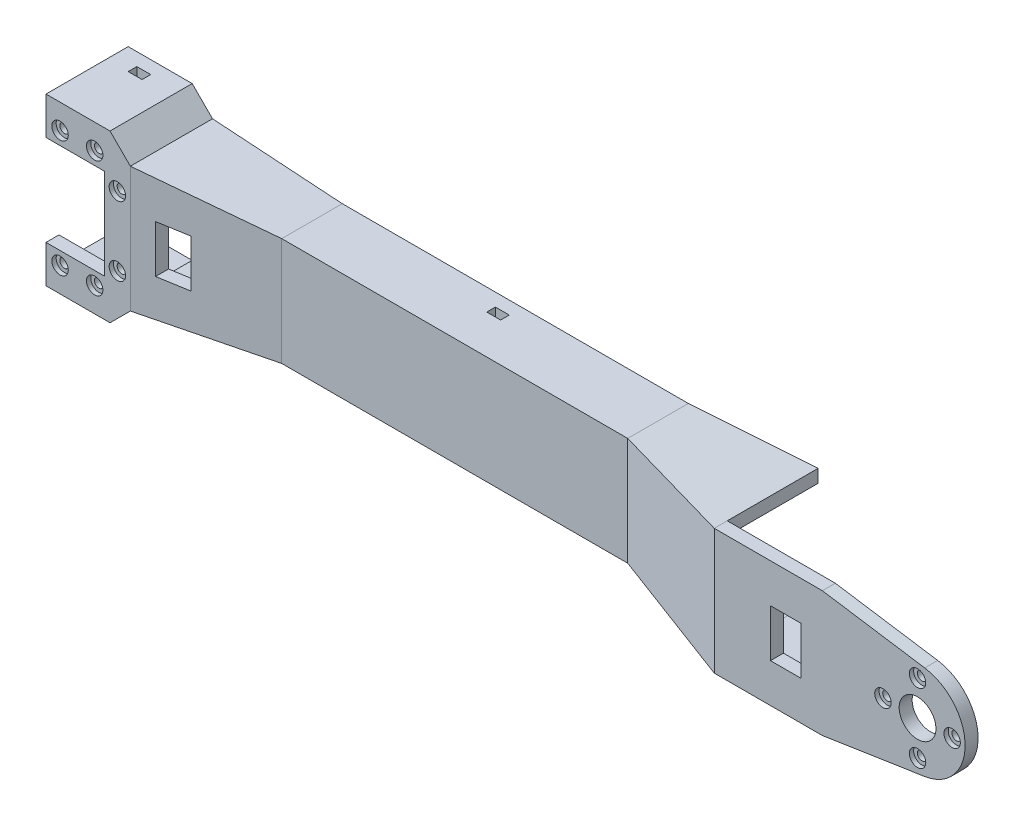
from build123d import *

# Parameters (mm, degrees)
BOSS_EXTRUDE1_DEPTH = 3
CUT_EXTRUDE1_REACH  = 66.915
SKETCH2_R           = 4.25
SKETCH2_R_2         = 1.05
SKETCH3_R           = 1.9
CUT_EXTRUDE2_DEPTH  = 1
BOSS_EXTRUDE2_DEPTH = 29
BOSS_EXTRUDE4_DEPTH = 3
CUT_EXTRUDE3_REACH  = 165.217
SKETCH8_R           = 1.05
SKETCH9_R           = 1.9
CUT_EXTRUDE4_DEPTH  = 1
CUT_EXTRUDE5_REACH  = 165.539
BOSS_EXTRUDE8_REACH = 166.778
SKETCH16_W          = 3.2
SKETCH16_H          = 2
CUT_EXTRUDE6_DEPTH  = 166.80352831
CUT_EXTRUDE7_REACH  = 166.778
SKETCH17_W          = 7
SKETCH17_H          = 11
SKETCH18_W          = 25
SKETCH18_H          = 3
CUT_EXTRUDE8_DEPTH  = 21


with BuildPart() as part:
    # Sketch1 → Boss-Extrude1 (new body)
    with BuildSketch(Plane.XY):
        with BuildLine():
            Line((25, 29), (48.666332079, 25.373055569))
            ThreePointArc((48.666332079, 25.373055569), (58, 14.5), (48.666332079, 3.626944431))
            Line((48.666332079, 3.626944431), (25, 0))
            Line((25, 0), (0, 0))
            Line((0, 0), (0, 29))
            Line((0, 29), (25, 29))
        make_face()
    extrude(amount=-BOSS_EXTRUDE1_DEPTH)

    # Sketch2 → Cut-Extrude1 (cut, up to next)
    with BuildSketch(Plane.XY, mode=Mode.PRIVATE) as cut_extrude1_sk1:
        with Locations((47, 14.5)):
            Circle(SKETCH2_R)
    cut_extrude1_tool1 = extrude(cut_extrude1_sk1.sketch, amount=-CUT_EXTRUDE1_REACH, mode=Mode.PRIVATE) & part.part
    # Sketch2 → Cut-Extrude1 (cut, up to next)
    with BuildSketch(Plane.XY, mode=Mode.PRIVATE) as cut_extrude1_sk2:
        with Locations((47, 22.5)):
            Circle(SKETCH2_R_2)
    cut_extrude1_tool2 = extrude(cut_extrude1_sk2.sketch, amount=-CUT_EXTRUDE1_REACH, mode=Mode.PRIVATE) & part.part
    # Sketch2 → Cut-Extrude1 (cut, up to next)
    with BuildSketch(Plane.XY, mode=Mode.PRIVATE) as cut_extrude1_sk3:
        with Locations((55, 14.5)):
            Circle(SKETCH2_R_2)
    cut_extrude1_tool3 = extrude(cut_extrude1_sk3.sketch, amount=-CUT_EXTRUDE1_REACH, mode=Mode.PRIVATE) & part.part
    # Sketch2 → Cut-Extrude1 (cut, up to next)
    with BuildSketch(Plane.XY, mode=Mode.PRIVATE) as cut_extrude1_sk4:
        with Locations((47, 6.5)):
            Circle(SKETCH2_R_2)
    cut_extrude1_tool4 = extrude(cut_extrude1_sk4.sketch, amount=-CUT_EXTRUDE1_REACH, mode=Mode.PRIVATE) & part.part
    # Sketch2 → Cut-Extrude1 (cut, up to next)
    with BuildSketch(Plane.XY, mode=Mode.PRIVATE) as cut_extrude1_sk5:
        with Locations((39, 14.5)):
            Circle(SKETCH2_R_2)
    cut_extrude1_tool5 = extrude(cut_extrude1_sk5.sketch, amount=-CUT_EXTRUDE1_REACH, mode=Mode.PRIVATE) & part.part
    add(cut_extrude1_tool1.solids().sort_by_distance((47, 14.5, 0))[0], mode=Mode.SUBTRACT)
    add(cut_extrude1_tool2.solids().sort_by_distance((47, 22.5, 0))[0], mode=Mode.SUBTRACT)
    add(cut_extrude1_tool3.solids().sort_by_distance((55, 14.5, 0))[0], mode=Mode.SUBTRACT)
    add(cut_extrude1_tool4.solids().sort_by_distance((47, 6.5, 0))[0], mode=Mode.SUBTRACT)
    add(cut_extrude1_tool5.solids().sort_by_distance((39, 14.5, 0))[0], mode=Mode.SUBTRACT)

    # Sketch3 → Cut-Extrude2 (cut)
    with BuildSketch(Plane.XY):
        with Locations((47, 22.5)):
            Circle(SKETCH3_R)
        with Locations((55, 14.5)):
            Circle(SKETCH3_R)
        with Locations((47, 6.5)):
            Circle(SKETCH3_R)
        with Locations((39, 14.5)):
            Circle(SKETCH3_R)
    extrude(amount=-CUT_EXTRUDE2_DEPTH, mode=Mode.SUBTRACT)

    # Sketch4 → Boss-Extrude2 (add)
    with BuildSketch(Plane(origin=(0, 29, 0), x_dir=(1, 0, 0), z_dir=(0, 1, 0))):
        Polygon((0, 3), (0, 0), (-30, 10), (-110, 10), (-140, 5), (-140, 8), (-110, 13), (-30, 13), align=None)
    extrude(amount=-BOSS_EXTRUDE2_DEPTH)

    # Sketch7 → Boss-Extrude4 (add)
    with BuildSketch(Plane.XY.offset(-5)):
        Polygon((-140, 29), (-144.7, 33.7), (-159.5, 33.7), (-159.5, 25), (-146, 25), (-146, 4), (-159.5, 4), (-159.5, -4.7), (-144.7, -4.7), (-140, 0), align=None)
    extrude(amount=-BOSS_EXTRUDE4_DEPTH)

    # Sketch8 → Cut-Extrude3 (cut, up to next)
    with BuildSketch(Plane.XY.offset(-5), mode=Mode.PRIVATE) as cut_extrude3_sk1:
        with Locations((-156.25, 28)):
            Circle(SKETCH8_R)
    cut_extrude3_tool1 = extrude(cut_extrude3_sk1.sketch, amount=-CUT_EXTRUDE3_REACH, mode=Mode.PRIVATE) & part.part
    # Sketch8 → Cut-Extrude3 (cut, up to next)
    with BuildSketch(Plane.XY.offset(-5), mode=Mode.PRIVATE) as cut_extrude3_sk2:
        with Locations((-148.25, 28)):
            Circle(SKETCH8_R)
    cut_extrude3_tool2 = extrude(cut_extrude3_sk2.sketch, amount=-CUT_EXTRUDE3_REACH, mode=Mode.PRIVATE) & part.part
    # Sketch8 → Cut-Extrude3 (cut, up to next)
    with BuildSketch(Plane.XY.offset(-5), mode=Mode.PRIVATE) as cut_extrude3_sk3:
        with Locations((-143, 22.5)):
            Circle(SKETCH8_R)
    cut_extrude3_tool3 = extrude(cut_extrude3_sk3.sketch, amount=-CUT_EXTRUDE3_REACH, mode=Mode.PRIVATE) & part.part
    # Sketch8 → Cut-Extrude3 (cut, up to next)
    with BuildSketch(Plane.XY.offset(-5), mode=Mode.PRIVATE) as cut_extrude3_sk4:
        with Locations((-143, 6.5)):
            Circle(SKETCH8_R)
    cut_extrude3_tool4 = extrude(cut_extrude3_sk4.sketch, amount=-CUT_EXTRUDE3_REACH, mode=Mode.PRIVATE) & part.part
    # Sketch8 → Cut-Extrude3 (cut, up to next)
    with BuildSketch(Plane.XY.offset(-5), mode=Mode.PRIVATE) as cut_extrude3_sk5:
        with Locations((-148.25, 1)):
            Circle(SKETCH8_R)
    cut_extrude3_tool5 = extrude(cut_extrude3_sk5.sketch, amount=-CUT_EXTRUDE3_REACH, mode=Mode.PRIVATE) & part.part
    # Sketch8 → Cut-Extrude3 (cut, up to next)
    with BuildSketch(Plane.XY.offset(-5), mode=Mode.PRIVATE) as cut_extrude3_sk6:
        with Locations((-156.25, 1)):
            Circle(SKETCH8_R)
    cut_extrude3_tool6 = extrude(cut_extrude3_sk6.sketch, amount=-CUT_EXTRUDE3_REACH, mode=Mode.PRIVATE) & part.part
    add(cut_extrude3_tool1.solids().sort_by_distance((-156.25, 28, -5))[0], mode=Mode.SUBTRACT)
    add(cut_extrude3_tool2.solids().sort_by_distance((-148.25, 28, -5))[0], mode=Mode.SUBTRACT)
    add(cut_extrude3_tool3.solids().sort_by_distance((-143, 22.5, -5))[0], mode=Mode.SUBTRACT)
    add(cut_extrude3_tool4.solids().sort_by_distance((-143, 6.5, -5))[0], mode=Mode.SUBTRACT)
    add(cut_extrude3_tool5.solids().sort_by_distance((-148.25, 1, -5))[0], mode=Mode.SUBTRACT)
    add(cut_extrude3_tool6.solids().sort_by_distance((-156.25, 1, -5))[0], mode=Mode.SUBTRACT)

    # Sketch9 → Cut-Extrude4 (cut)
    with BuildSketch(Plane.XY.offset(-5)):
        with Locations((-156.25, 28)):
            Circle(SKETCH9_R)
        with Locations((-148.25, 28)):
            Circle(SKETCH9_R)
        with Locations((-143, 22.5)):
            Circle(SKETCH9_R)
        with Locations((-143, 6.5)):
            Circle(SKETCH9_R)
        with Locations((-148.25, 1)):
            Circle(SKETCH9_R)
        with Locations((-156.25, 1)):
            Circle(SKETCH9_R)
    extrude(amount=-CUT_EXTRUDE4_DEPTH, mode=Mode.SUBTRACT)

    # Cut-Extrude5: up to this face of the body (flat: up to its plane)
    cut_extrude5_end = Plane(part.part.faces().sort_by_distance((-70, 14.5, -13))[0])
    # Sketch11 → Cut-Extrude5 (cut, up to the picked face)
    with BuildSketch(Plane.XY, mode=Mode.PRIVATE) as cut_extrude5_sk1:
        Polygon((0, 0), (-30, 2), (-110, 2), (-140, 0), align=None)
    cut_extrude5_tool1 = split(extrude(cut_extrude5_sk1.sketch, amount=-CUT_EXTRUDE5_REACH, mode=Mode.PRIVATE), bisect_by=cut_extrude5_end, keep=Keep.BOTH, mode=Mode.PRIVATE)
    # Sketch11 → Cut-Extrude5 (cut, up to the picked face)
    with BuildSketch(Plane.XY, mode=Mode.PRIVATE) as cut_extrude5_sk2:
        Polygon((0, 29), (-30, 27), (-110, 27), (-140, 29), align=None)
    cut_extrude5_tool2 = split(extrude(cut_extrude5_sk2.sketch, amount=-CUT_EXTRUDE5_REACH, mode=Mode.PRIVATE), bisect_by=cut_extrude5_end, keep=Keep.BOTH, mode=Mode.PRIVATE)
    add(cut_extrude5_tool1.solids().sort_by(Axis((-70, 0.909091, 0), (0, 0, -1)))[0], mode=Mode.SUBTRACT)
    add(cut_extrude5_tool2.solids().sort_by(Axis((-70, 28.090909, 0), (0, 0, -1)))[0], mode=Mode.SUBTRACT)

    # Sketch14 → Boss-Extrude8 (add, up to next)
    with BuildSketch(Plane.XY.offset(-24), mode=Mode.PRIVATE) as boss_extrude8_sk1:
        Polygon((-159.5, 33.7), (-159.5, 30.7), (-144.7, 30.7), (-140, 26), (-110, 24), (-30, 24), (0, 26), (25, 26), (25, 29), (0, 29), (-30, 27), (-110, 27), (-140, 29), (-144.7, 33.7), align=None)
    boss_extrude8_tool1 = extrude(boss_extrude8_sk1.sketch, amount=BOSS_EXTRUDE8_REACH, mode=Mode.PRIVATE) - part.part
    boss_extrude8 = boss_extrude8_tool1.solids().sort_by_distance((-67.25, 26.744472, -24))[0]
    add(boss_extrude8)

    # Mirror1: Boss-Extrude8 across plane
    add(boss_extrude8.mirror(Plane.ZX.offset(14.5)))

    # Sketch16 → Cut-Extrude6 (cut, through all)
    with BuildSketch(Plane(origin=(0, 33.7, 0), x_dir=(1, 0, 0), z_dir=(0, 1, 0))):
        with Locations((-152.9, 20)):
            Rectangle(SKETCH16_W, SKETCH16_H)
        with Locations((-70, 20)):
            Rectangle(SKETCH16_W, SKETCH16_H)
        with Locations((10.6, 20)):
            Rectangle(SKETCH16_W, SKETCH16_H)
    extrude(amount=-CUT_EXTRUDE6_DEPTH, mode=Mode.SUBTRACT)

    # Sketch17 → Cut-Extrude7 (cut, up to next)
    with BuildSketch(Plane.XY, mode=Mode.PRIVATE) as cut_extrude7_sk1:
        with Locations((-131.5, 14.5)):
            Rectangle(SKETCH17_W, SKETCH17_H)
    cut_extrude7_tool1 = extrude(cut_extrude7_sk1.sketch, amount=-CUT_EXTRUDE7_REACH, mode=Mode.PRIVATE) & part.part
    # Sketch17 → Cut-Extrude7 (cut, up to next)
    with BuildSketch(Plane.XY, mode=Mode.PRIVATE) as cut_extrude7_sk2:
        with Locations((16.5, 14.5)):
            Rectangle(SKETCH17_W, SKETCH17_H)
    cut_extrude7_tool2 = extrude(cut_extrude7_sk2.sketch, amount=-CUT_EXTRUDE7_REACH, mode=Mode.PRIVATE) & part.part
    add(cut_extrude7_tool1.solids().sort_by_distance((-131.5, 14.5, 0))[0], mode=Mode.SUBTRACT)
    add(cut_extrude7_tool2.solids().sort_by_distance((16.5, 14.5, 0))[0], mode=Mode.SUBTRACT)

    # Sketch18 → Cut-Extrude8 (cut)
    with BuildSketch(Plane(origin=(0, 0, -24), x_dir=(-1, 0, 0), z_dir=(0, 0, -1))):
        with Locations((-12.5, 27.5)):
            Rectangle(SKETCH18_W, SKETCH18_H)
    extrude(amount=-CUT_EXTRUDE8_DEPTH, mode=Mode.SUBTRACT)


solid = part.part
